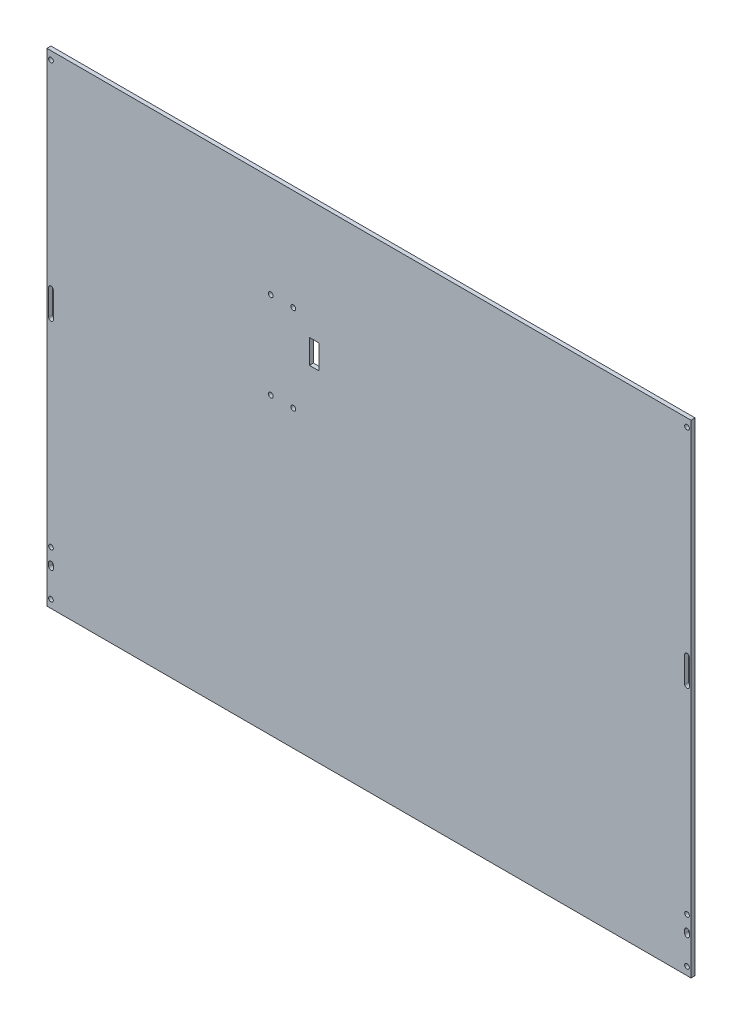
from build123d import *

# Parameters (mm, degrees)
SKETCH1_W           = 508
SKETCH1_H           = 381
BOSS_EXTRUDE1_DEPTH = 3.175
SKETCH3_W           = 7.62
SKETCH3_H           = 19.05
CUT_EXTRUDE2_DEPTH  = 3.175
SKETCH2_R           = 1.8542
SKETCH2_R_2         = 1.905
CUT_EXTRUDE1_DEPTH  = 3.175


with BuildPart() as part:
    # Sketch1 → Boss-Extrude1 (new body)
    with BuildSketch(Plane.XY):
        Rectangle(SKETCH1_W, SKETCH1_H)
    extrude(amount=BOSS_EXTRUDE1_DEPTH)

    # Sketch3 → Cut-Extrude2 (cut)
    with BuildSketch(Plane.XY.offset(3.175)):
        with Locations((-43.18, 86.995)):
            Rectangle(SKETCH3_W, SKETCH3_H)
    extrude(amount=-CUT_EXTRUDE2_DEPTH, mode=Mode.SUBTRACT)

    # Sketch2 → Cut-Extrude1 (cut)
    with BuildSketch(Plane.XY.offset(3.175)):
        with Locations((-250.825, -184.15)):
            Circle(SKETCH2_R)
        with Locations((-250.825, 184.15)):
            Circle(SKETCH2_R)
        with Locations((250.825, 184.15)):
            Circle(SKETCH2_R)
        with Locations((250.825, -184.15)):
            Circle(SKETCH2_R)
        with Locations((-250.825, -148.59)):
            Circle(SKETCH2_R)
        with Locations(Location((250.825, -148.59, 0), (0, 0, 180))):
            Circle(SKETCH2_R)
        with Locations((-77.488669, 110.49)):
            Circle(SKETCH2_R_2)
        with Locations((-77.488669, 41.91)):
            Circle(SKETCH2_R_2)
        with Locations((-59.708669, 110.49)):
            Circle(SKETCH2_R_2)
        with Locations((-59.708669, 41.91)):
            Circle(SKETCH2_R_2)
        with BuildLine():
            Line((-252.6792, 20.32), (-252.6792, 27.94))
            ThreePointArc((-252.6792, 27.94), (-250.825, 29.7942), (-248.9708, 27.94))
            Line((-248.9708, 27.94), (-248.9708, 20.32))
            Line((-248.9708, 20.32), (-248.9708, 15.24))
            Line((-248.9708, 15.24), (-248.9708, 7.62))
            ThreePointArc((-248.9708, 7.62), (-250.825, 5.7658), (-252.6792, 7.62))
            Line((-252.6792, 7.62), (-252.6792, 15.24))
            Line((-252.6792, 15.24), (-252.6792, 20.32))
        make_face()
        with BuildLine():
            Line((248.9708, 20.32), (248.9708, 27.94))
            ThreePointArc((248.9708, 27.94), (250.825, 29.7942), (252.6792, 27.94))
            Line((252.6792, 27.94), (252.6792, 20.32))
            Line((252.6792, 20.32), (252.6792, 15.24))
            Line((252.6792, 15.24), (252.6792, 7.62))
            ThreePointArc((252.6792, 7.62), (250.825, 5.7658), (248.9708, 7.62))
            Line((248.9708, 7.62), (248.9708, 15.24))
            Line((248.9708, 15.24), (248.9708, 20.32))
        make_face()
        with BuildLine():
            Line((-252.6792, -162.56), (-252.6792, -160.02))
            ThreePointArc((-252.6792, -160.02), (-250.825, -158.1658), (-248.9708, -160.02))
            Line((-248.9708, -160.02), (-248.9708, -162.56))
            ThreePointArc((-248.9708, -162.56), (-250.825, -164.4142), (-252.6792, -162.56))
        make_face()
        with BuildLine():
            Line((252.6792, -162.56), (252.6792, -160.02))
            ThreePointArc((252.6792, -160.02), (250.825, -158.1658), (248.9708, -160.02))
            Line((248.9708, -160.02), (248.9708, -162.56))
            ThreePointArc((248.9708, -162.56), (250.825, -164.4142), (252.6792, -162.56))
        make_face()
    extrude(amount=-CUT_EXTRUDE1_DEPTH, mode=Mode.SUBTRACT)


solid = part.part
